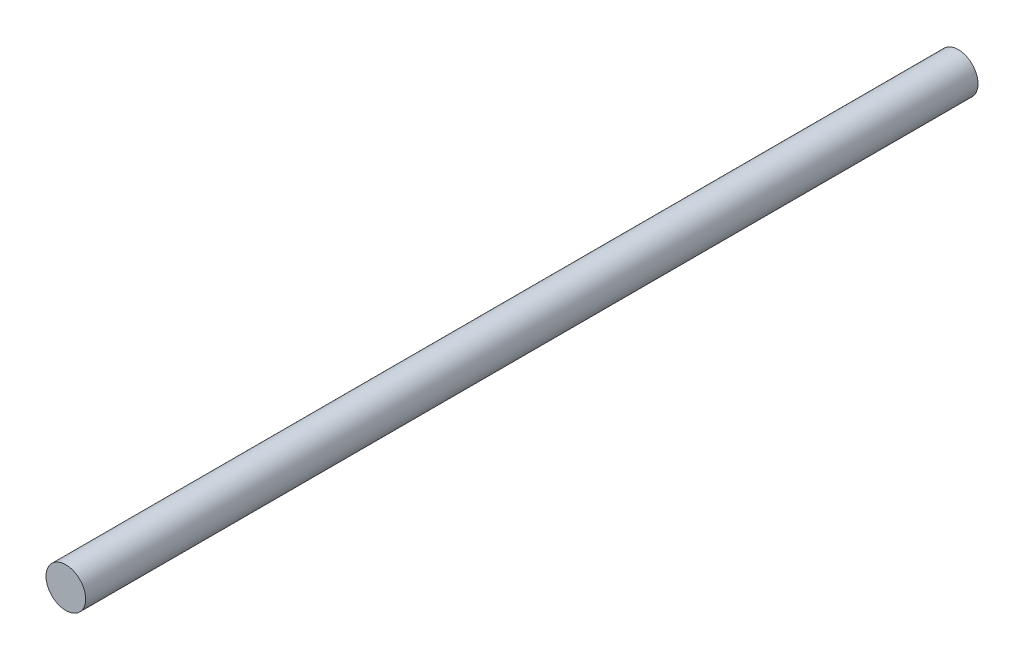
from build123d import *

# Parameters (mm, degrees)
CROQUIS1_R              = 4
SALIENTE_EXTRUIR1_DEPTH = 180


with BuildPart() as part:
    # Croquis1 → Saliente-Extruir1 (new body)
    with BuildSketch(Plane.XY):
        with Locations(Location((0, 0, 0), (0, 0, 180))):
            Circle(CROQUIS1_R)
    extrude(amount=SALIENTE_EXTRUIR1_DEPTH)


solid = part.part
